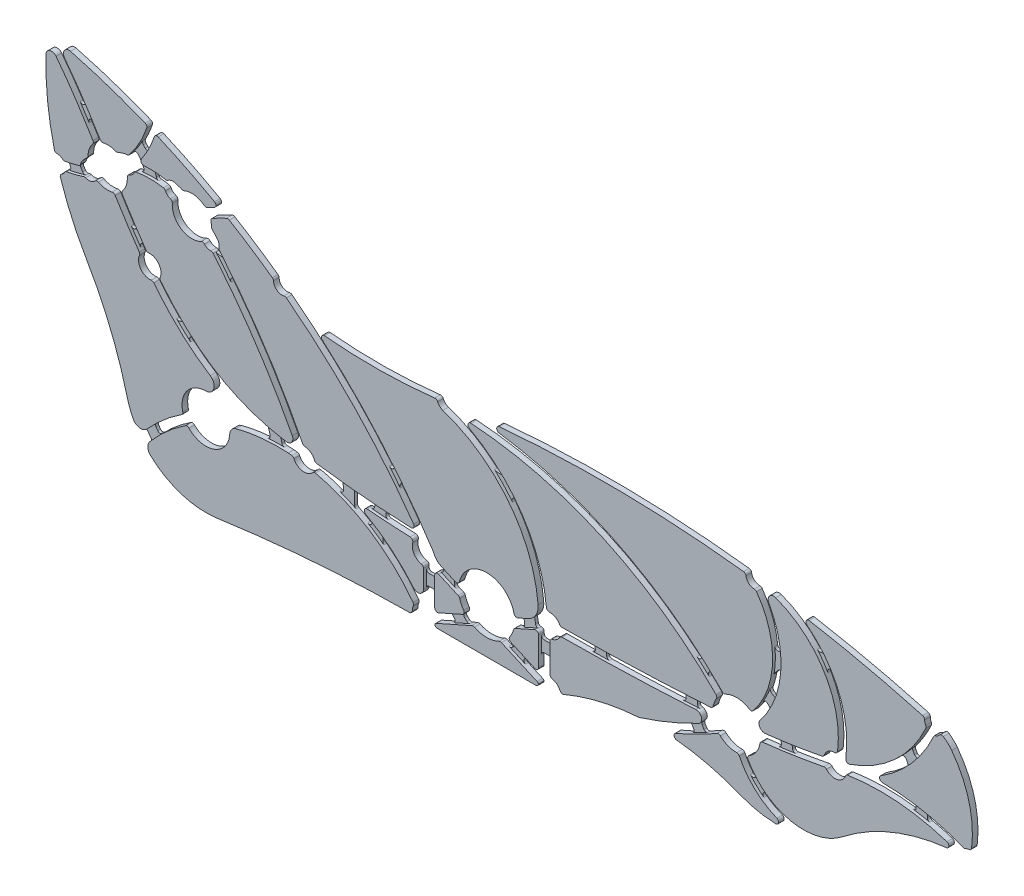
from build123d import *

# Parameters (mm, degrees)
EXTRUDE_1_DEPTH    = 2
EXTRUDE_1_2_DEPTH  = 2
EXTRUDE_1_3_DEPTH  = 2
EXTRUDE_1_4_DEPTH  = 2
EXTRUDE_1_5_DEPTH  = 2
EXTRUDE_1_6_DEPTH  = 2
EXTRUDE_1_7_DEPTH  = 2
EXTRUDE_1_8_DEPTH  = 2
EXTRUDE_1_9_DEPTH  = 2
EXTRUDE_1_10_DEPTH = 2
EXTRUDE_1_11_DEPTH = 2
EXTRUDE_1_12_DEPTH = 2
EXTRUDE_1_13_DEPTH = 2
EXTRUDE_1_14_DEPTH = 2
EXTRUDE_1_15_DEPTH = 2
EXTRUDE_1_16_DEPTH = 2
EXTRUDE_1_17_DEPTH = 2
EXTRUDE_1_18_DEPTH = 2
EXTRUDE_1_19_DEPTH = 2
EXTRUDE_1_20_DEPTH = 2
EXTRUDE_2_DEPTH    = 1


with BuildPart() as part:
    # ｽｹｯﾁ1 → ﾎﾞｽ - 押し出し1 (new body)
    with BuildSketch(Plane.XY):
        with BuildLine():
            Line((22.5, 0.101020514), (22.5, -10.101020514))
            ThreePointArc((22.5, -10.101020514), (22.725403331, -10.733476046), (23.3, -11.080816412))
            ThreePointArc((23.3, -11.080816412), (24.990478153, -11.869901188), (26.139219533, -13.339855069))
            ThreePointArc((26.139219533, -13.339855069), (26.685177052, -13.856277421), (27.436621612, -13.846647678))
            ThreePointArc((27.436621612, -13.846647678), (40.48832194, -9.598088167), (54.063947757, -7.573360277))
            ThreePointArc((54.063947757, -7.573360277), (54.184018837, -7.558239038), (54.301384043, -7.528724215))
            ThreePointArc((54.301384043, -7.528724215), (65.082931287, -3.594550625), (75.487010068, 1.250511558))
            ThreePointArc((75.487010068, 1.250511558), (76.493832753, 3.556551996), (74.448487112, 5.022183474))
            ThreePointArc((74.448487112, 5.022183474), (50.650061214, 3.946700568), (26.831338926, 3.510572931))
            ThreePointArc((26.831338926, 3.510572931), (26.333052589, 3.374773249), (25.968976767, 3.008467879))
            ThreePointArc((25.968976767, 3.008467879), (24.842007836, 1.757316035), (23.3, 1.080816412))
            ThreePointArc((23.3, 1.080816412), (22.725403331, 0.733476046), (22.5, 0.101020514))
        make_face()
    extrude(amount=-EXTRUDE_1_DEPTH)



with BuildPart() as body_2:
    # ｽｹｯﾁ1 → Extrude 1 2 (new body)
    with BuildSketch(Plane.XY):
        with BuildLine():
            Line((-22.5, -6.412581397), (-22.5, 0.101020514))
            ThreePointArc((-22.5, 0.101020514), (-22.725403331, 0.733476046), (-23.3, 1.080816412))
            ThreePointArc((-23.3, 1.080816412), (-25.924769368, 2.933371156), (-26.340268538, 6.119078888))
            ThreePointArc((-26.340268538, 6.119078888), (-26.488503415, 6.982739341), (-27.260130447, 7.398040053))
            ThreePointArc((-27.260130447, 7.398040053), (-34.893320679, 7.7891821), (-42.516080074, 8.347863062))
            ThreePointArc((-42.516080074, 8.347863062), (-43.555392432, 7.64713656), (-43.093796505, 6.481753786))
            ThreePointArc((-43.093796505, 6.481753786), (-33.93186129, 0.147888894), (-26.029417775, -7.701333223))
            ThreePointArc((-26.029417775, -7.701333223), (-23.81401004, -8.291255869), (-22.5, -6.412581397))
        make_face()
    extrude(amount=-EXTRUDE_1_2_DEPTH)


with BuildPart() as body_3:
    # ｽｹｯﾁ1 → Extrude 1 3 (new body)
    with BuildSketch(Plane.XY):
        with BuildLine():
            Line((-17.093861534, -10.955795493), (-8.626043939, -7.192321006))
            ThreePointArc((-8.626043939, -7.192321006), (-8.06909808, -6.547709353), (-8.211074914, -5.70773587))
            ThreePointArc((-8.211074914, -5.70773587), (-9.032200451, -4.291777604), (-9.611336633, -2.760834679))
            ThreePointArc((-9.611336633, -2.760834679), (-9.818127838, -2.380437031), (-10.166331831, -2.123106598))
            Line((-10.166331831, -2.123106598), (-17.093861534, 0.955795493))
            ThreePointArc((-17.093861534, 0.955795493), (-18.044913541, 0.880476182), (-18.5, 0.041983944))
            Line((-18.5, 0.041983944), (-18.5, -10.041983944))
            ThreePointArc((-18.5, -10.041983944), (-18.044913541, -10.880476182), (-17.093861534, -10.955795493))
        make_face()
    extrude(amount=-EXTRUDE_1_3_DEPTH)


with BuildPart() as body_4:
    # ｽｹｯﾁ1 → Extrude 1 4 (new body)
    with BuildSketch(Plane.XY):
        with BuildLine():
            Line((8.626043939, -7.192321006), (17.093861534, -10.955795493))
            ThreePointArc((17.093861534, -10.955795493), (18.044913541, -10.880476182), (18.5, -10.041983944))
            Line((18.5, -10.041983944), (18.5, 0.041983944))
            ThreePointArc((18.5, 0.041983944), (18.044913541, 0.880476182), (17.093861534, 0.955795493))
            Line((17.093861534, 0.955795493), (10.166331831, -2.123106598))
            ThreePointArc((10.166331831, -2.123106598), (9.818127838, -2.380437031), (9.611336633, -2.760834679))
            ThreePointArc((9.611336633, -2.760834679), (9.032200451, -4.291777604), (8.211074914, -5.70773587))
            ThreePointArc((8.211074914, -5.70773587), (8.06909808, -6.547709353), (8.626043939, -7.192321006))
        make_face()
    extrude(amount=-EXTRUDE_1_4_DEPTH)


with BuildPart() as body_5:
    # ｽｹｯﾁ1 → Extrude 1 5 (new body)
    with BuildSketch(Plane.XY):
        with BuildLine():
            Line((11.118968747, 1.583240188), (14.780704116, 3.210678129))
            ThreePointArc((14.780704116, 3.210678129), (17.508416253, 5.639452419), (18.322470408, 9.199884119))
            ThreePointArc((18.322470408, 9.199884119), (7.814521193, 35.812462193), (-15.610951372, 52.240899233))
            ThreePointArc((-15.610951372, 52.240899233), (-16.726416816, 52.906959729), (-17.45567904, 53.982169639))
            ThreePointArc((-17.45567904, 53.982169639), (-17.871800431, 54.471525722), (-18.499758812, 54.606783477))
            ThreePointArc((-18.499758812, 54.606783477), (-38.112812762, 53.374184357), (-57.747756386, 54.186695724))
            ThreePointArc((-57.747756386, 54.186695724), (-58.759792741, 53.585885084), (-58.499178516, 52.438160712))
            ThreePointArc((-58.499178516, 52.438160712), (-37.276714505, 31.160374537), (-19.152035998, 7.188866612))
            ThreePointArc((-19.152035998, 7.188866612), (-18.959270279, 6.860976368), (-18.798519535, 6.516259335))
            ThreePointArc((-18.798519535, 6.516259335), (-17.758858971, 4.928471706), (-16.202361285, 3.84252576))
            Line((-16.202361285, 3.84252576), (-11.118968747, 1.583240188))
            ThreePointArc((-11.118968747, 1.583240188), (-10.267282975, 1.601793339), (-9.738936619, 2.270047033))
            ThreePointArc((-9.738936619, 2.270047033), (0, 10), (9.738936619, 2.270047033))
            ThreePointArc((9.738936619, 2.270047033), (10.267282975, 1.601793339), (11.118968747, 1.583240188))
        make_face()
    extrude(amount=-EXTRUDE_1_5_DEPTH)


with BuildPart() as body_6:
    # ｽｹｯﾁ1 → Extrude 1 6 (new body)
    with BuildSketch(Plane.XY):
        with BuildLine():
            Line((-17.5, -16), (17.5, -16))
            ThreePointArc((17.5, -16), (18.127636647, -15.778506416), (18.477238313, -15.212144479))
            ThreePointArc((18.477238313, -15.212144479), (18.268989106, -14.854674582), (17.933872224, -14.612086178))
            Line((17.933872224, -14.612086178), (5.236576226, -8.968843512))
            ThreePointArc((5.236576226, -8.968843512), (4.812235497, -8.882820735), (4.391307055, -8.984231873))
            ThreePointArc((4.391307055, -8.984231873), (0, -10), (-4.391307055, -8.984231873))
            ThreePointArc((-4.391307055, -8.984231873), (-4.812235497, -8.882820735), (-5.236576226, -8.968843512))
            Line((-5.236576226, -8.968843512), (-17.933872224, -14.612086178))
            ThreePointArc((-17.933872224, -14.612086178), (-18.268989106, -14.854674582), (-18.477238313, -15.212144479))
            ThreePointArc((-18.477238313, -15.212144479), (-18.127636647, -15.778506416), (-17.5, -16))
        make_face()
    extrude(amount=-EXTRUDE_1_6_DEPTH)


with BuildPart() as body_7:
    # ｽｹｯﾁ1 → Extrude 1 7 (new body)
    with BuildSketch(Plane.XY):
        with BuildLine():
            ThreePointArc((83.211270872, 1.275804061), (85.918070339, -0.421597665), (89.060304278, -0.999786079))
            ThreePointArc((89.060304278, -0.999786079), (89.595121172, -1.150343934), (89.967031901, -1.563114074))
            ThreePointArc((89.967031901, -1.563114074), (95.498956322, -9.057744291), (103.356558634, -14.060718986))
            ThreePointArc((103.356558634, -14.060718986), (103.962078134, -15.191111022), (102.957342201, -15.987945839))
            ThreePointArc((102.957342201, -15.987945839), (96.419112305, -15.235486438), (90.117629525, -13.336549869))
            ThreePointArc((90.117629525, -13.336549869), (79.072499433, -9.782229594), (67.637822736, -7.813407558))
            ThreePointArc((67.637822736, -7.813407558), (66.749100435, -6.968649503), (67.34675765, -5.898019149))
            ThreePointArc((67.34675765, -5.898019149), (74.799057097, -2.464433401), (82.031739222, 1.410432715))
            ThreePointArc((82.031739222, 1.410432715), (82.64364503, 1.537095003), (83.211270872, 1.275804061))
        make_face()
    extrude(amount=-EXTRUDE_1_7_DEPTH)


with BuildPart() as body_8:
    # ｽｹｯﾁ1 → Extrude 1 8 (new body)
    with BuildSketch(Plane.XY):
        with BuildLine():
            ThreePointArc((163.920291551, 8.977503239), (146.403950854, 12.457005785), (128.557163274, 11.807927609))
            ThreePointArc((128.557163274, 11.807927609), (128.07237572, 11.59059704), (127.76731798, 11.155635749))
            ThreePointArc((127.76731798, 11.155635749), (124.75804267, 8.572485352), (121.003592282, 9.850180989))
            ThreePointArc((121.003592282, 9.850180989), (120.575847385, 10.134684344), (120.063293842, 10.169278015))
            ThreePointArc((120.063293842, 10.169278015), (109.189695688, 8.283956274), (98.247377431, 6.850343342))
            ThreePointArc((98.247377431, 6.850343342), (97.672725088, 6.585818326), (97.371810397, 6.029357053))
            ThreePointArc((97.371810397, 6.029357053), (96.028031748, 2.719124583), (93.442710672, 0.253461386))
            ThreePointArc((93.442710672, 0.253461386), (93.00002742, -0.338132848), (93.084381906, -1.072187697))
            ThreePointArc((93.084381906, -1.072187697), (108.261136719, -12.427077278), (126.720890547, -8.125345919))
            ThreePointArc((126.720890547, -8.125345919), (144.171431804, 2.021447824), (163.725732783, 7.032248826))
            ThreePointArc((163.725732783, 7.032248826), (164.608066794, 7.92635712), (163.920291551, 8.977503239))
        make_face()
    extrude(amount=-EXTRUDE_1_8_DEPTH)


with BuildPart() as body_9:
    # ｽｹｯﾁ1 → Extrude 1 9 (new body)
    with BuildSketch(Plane.XY):
        with BuildLine():
            ThreePointArc((129.217245632, 15.498903244), (145.340870587, 25.04107642), (156.400178828, 40.164437549))
            ThreePointArc((156.400178828, 40.164437549), (156.490114246, 40.616134725), (156.368067103, 41.060232927))
            ThreePointArc((156.368067103, 41.060232927), (156.085215089, 41.790050054), (156.000775173, 42.568194129))
            ThreePointArc((156.000775173, 42.568194129), (155.803951642, 43.187014896), (155.268554706, 43.554477497))
            ThreePointArc((155.268554706, 43.554477497), (135.171119836, 48.606684839), (114.850046871, 52.666941105))
            ThreePointArc((114.850046871, 52.666941105), (113.765093768, 52.089460809), (114.059534107, 50.896183133))
            ThreePointArc((114.059534107, 50.896183133), (125.547381919, 35.580716416), (127.900790598, 16.580831267))
            ThreePointArc((127.900790598, 16.580831267), (128.25649785, 15.67177038), (129.217245632, 15.498903244))
        make_face()
    extrude(amount=-EXTRUDE_1_9_DEPTH)


with BuildPart() as body_10:
    # ｽｹｯﾁ1 → Extrude 1 10 (new body)
    with BuildSketch(Plane.XY):
        with BuildLine():
            ThreePointArc((171.785964151, 10.492355035), (171.155696028, 10.378741184), (170.563904339, 10.133937974))
            ThreePointArc((170.563904339, 10.133937974), (170.14622041, 10.013780427), (169.717010958, 10.08216864))
            ThreePointArc((169.717010958, 10.08216864), (155.581300438, 14.221758305), (140.92626069, 15.699704338))
            ThreePointArc((140.92626069, 15.699704338), (139.972472291, 16.427013854), (140.402865662, 17.546591002))
            ThreePointArc((140.402865662, 17.546591002), (151.384643178, 26.924630489), (159.197974761, 39.069543482))
            ThreePointArc((159.197974761, 39.069543482), (159.454634512, 39.413102568), (159.831599898, 39.617563251))
            ThreePointArc((159.831599898, 39.617563251), (160.648344956, 39.993416886), (161.317043281, 40.594400243))
            ThreePointArc((161.317043281, 40.594400243), (161.947741849, 40.949117243), (162.652608619, 40.785508959))
            ThreePointArc((162.652608619, 40.785508959), (164.259804057, 39.486741818), (165.635293674, 37.944697209))
            ThreePointArc((165.635293674, 37.944697209), (171.77520359, 25.346722117), (172.706566648, 11.363159157))
            ThreePointArc((172.706566648, 11.363159157), (172.401803697, 10.763324084), (171.785964151, 10.492355035))
        make_face()
    extrude(amount=-EXTRUDE_1_10_DEPTH)


with BuildPart() as body_11:
    # ｽｹｯﾁ1 → Extrude 1 11 (new body)
    with BuildSketch(Plane.XY):
        with BuildLine():
            ThreePointArc((93.586754605, 14.6562338), (89.394333262, 15.990848089), (85.096260122, 15.05055064))
            ThreePointArc((85.096260122, 15.05055064), (84.479111763, 14.951393184), (83.923649691, 15.238039629))
            ThreePointArc((83.923649691, 15.238039629), (47.483352354, 41.826061968), (4.422429146, 55.263885244))
            ThreePointArc((4.422429146, 55.263885244), (3.560849299, 56.278744516), (4.470999079, 57.250282757))
            ThreePointArc((4.470999079, 57.250282757), (48.007817114, 58.908356302), (91.48378022, 56.07209741))
            ThreePointArc((91.48378022, 56.07209741), (92.069225942, 55.791149679), (92.358682449, 55.209863819))
            ThreePointArc((92.358682449, 55.209863819), (93.350087626, 53.351369569), (95.318967313, 52.602772294))
            ThreePointArc((95.318967313, 52.602772294), (95.774491653, 52.49062391), (96.128746209, 52.183079777))
            ThreePointArc((96.128746209, 52.183079777), (101.822459182, 33.316779439), (94.900870104, 14.865566457))
            ThreePointArc((94.900870104, 14.865566457), (94.283684874, 14.510594718), (93.586754605, 14.6562338))
        make_face()
    extrude(amount=-EXTRUDE_1_11_DEPTH)


with BuildPart() as body_12:
    # ｽｹｯﾁ1 → Extrude 1 12 (new body)
    with BuildSketch(Plane.XY):
        with BuildLine():
            ThreePointArc((81.667277078, 13.253873919), (41.702064453, 41.277821121), (-5.609573539, 53.284850211))
            ThreePointArc((-5.609573539, 53.284850211), (-6.637189872, 52.564938691), (-6.152522338, 51.407629179))
            ThreePointArc((-6.152522338, 51.407629179), (12.757832942, 34.089272661), (21.271842987, 9.901700598))
            ThreePointArc((21.271842987, 9.901700598), (21.611427135, 9.239911484), (22.314015361, 8.995673875))
            ThreePointArc((22.314015361, 8.995673875), (24.414609558, 8.512017973), (25.959198864, 7.008467879))
            ThreePointArc((25.959198864, 7.008467879), (26.327181142, 6.642729772), (26.828894412, 6.510596833))
            ThreePointArc((26.828894412, 6.510596833), (53.301872163, 7.036667802), (79.74722804, 8.355172349))
            ThreePointArc((79.74722804, 8.355172349), (80.341592557, 8.601026945), (80.663274603, 9.158013769))
            ThreePointArc((80.663274603, 9.158013769), (81.101716083, 10.641195817), (81.801654702, 12.020378853))
            ThreePointArc((81.801654702, 12.020378853), (81.94890883, 12.660487916), (81.667277078, 13.253873919))
        make_face()
    extrude(amount=-EXTRUDE_1_12_DEPTH)


with BuildPart() as body_13:
    # ｽｹｯﾁ1 → Extrude 1 13 (new body)
    with BuildSketch(Plane.XY):
        with BuildLine():
            ThreePointArc((97.424637255, 13.215415929), (97.235079465, 10.997428592), (99.214022424, 9.978024479))
            ThreePointArc((99.214022424, 9.978024479), (109.36232121, 11.345501175), (119.449838366, 13.106171051))
            ThreePointArc((119.449838366, 13.106171051), (119.918131969, 13.335906367), (120.207034495, 13.770201826))
            ThreePointArc((120.207034495, 13.770201826), (121.659362935, 15.743673555), (123.98999328, 16.499987483))
            ThreePointArc((123.98999328, 16.499987483), (124.649769443, 16.750726015), (124.979615741, 17.374725869))
            ThreePointArc((124.979615741, 17.374725869), (120.295248245, 39.392547584), (102.944576602, 53.73416414))
            ThreePointArc((102.944576602, 53.73416414), (100.727848949, 53.158409228), (100.505114473, 50.878987248))
            ThreePointArc((100.505114473, 50.878987248), (104.726719606, 31.575944409), (97.424637255, 13.215415929))
        make_face()
    extrude(amount=-EXTRUDE_1_13_DEPTH)


with BuildPart() as body_14:
    # ｽｹｯﾁ1 → Extrude 1 14 (new body)
    with BuildSketch(Plane.XY):
        with BuildLine():
            ThreePointArc((-92.646482628, 72.972153264), (-95.226633677, 71.724656509), (-97.750631704, 70.36713614))
            ThreePointArc((-97.750631704, 70.36713614), (-98.178932991, 69.886768371), (-98.225822663, 69.244898802))
            ThreePointArc((-98.225822663, 69.244898802), (-98.063053837, 68.418663332), (-98.000680849, 67.578860765))
            ThreePointArc((-98.000680849, 67.578860765), (-97.921285564, 67.202082756), (-97.705410986, 66.8832357))
            ThreePointArc((-97.705410986, 66.8832357), (-96.845691965, 65.995488705), (-96.021295968, 65.074846127))
            ThreePointArc((-96.021295968, 65.074846127), (-95.395423067, 63.8877696), (-95.349720401, 62.546583993))
            ThreePointArc((-95.349720401, 62.546583993), (-95.336157636, 62.105899259), (-95.134397943, 61.713878839))
            ThreePointArc((-95.134397943, 61.713878839), (-79.093035157, 40.212538503), (-65.583431059, 17.036612343))
            ThreePointArc((-65.583431059, 17.036612343), (-65.240913382, 16.654395429), (-64.753909299, 16.492422744))
            ThreePointArc((-64.753909299, 16.492422744), (-62.655797065, 15.741097437), (-61.285349547, 13.983702131))
            ThreePointArc((-61.285349547, 13.983702131), (-60.972999003, 13.567125642), (-60.493566976, 13.364040033))
            ThreePointArc((-60.493566976, 13.364040033), (-43.722386211, 11.463371837), (-26.878319095, 10.385203561))
            ThreePointArc((-26.878319095, 10.385203561), (-25.960207207, 10.906984019), (-26.021967296, 11.961199356))
            ThreePointArc((-26.021967296, 11.961199356), (-46.898048291, 37.235706645), (-71.343129401, 59.077169187))
            ThreePointArc((-71.343129401, 59.077169187), (-71.750387624, 59.262904595), (-72.197875937, 59.252363596))
            ThreePointArc((-72.197875937, 59.252363596), (-74.72769572, 59.751974852), (-75.935182614, 62.030477638))
            ThreePointArc((-75.935182614, 62.030477638), (-76.054051204, 62.462018089), (-76.349274765, 62.798470094))
            ThreePointArc((-76.349274765, 62.798470094), (-83.925565639, 68.022389418), (-91.716533423, 72.920382631))
            ThreePointArc((-91.716533423, 72.920382631), (-92.1751128, 73.061144555), (-92.646482628, 72.972153264))
        make_face()
    extrude(amount=-EXTRUDE_1_14_DEPTH)


with BuildPart() as body_15:
    # ｽｹｯﾁ1 → Extrude 1 15 (new body)
    with BuildSketch(Plane.XY):
        with BuildLine():
            ThreePointArc((-150.204030248, 61.786911622), (-147.74564025, 62.291578487), (-145.326579343, 62.959795782))
            ThreePointArc((-145.326579343, 62.959795782), (-144.882580356, 63.24428851), (-144.645024595, 63.715073466))
            ThreePointArc((-144.645024595, 63.715073466), (-144.399069128, 64.437692205), (-143.978704032, 65.074846127))
            ThreePointArc((-143.978704032, 65.074846127), (-143.154308035, 65.995488705), (-142.294589014, 66.8832357))
            ThreePointArc((-142.294589014, 66.8832357), (-142.078714436, 67.202082756), (-141.999319151, 67.578860765))
            ThreePointArc((-141.999319151, 67.578860765), (-141.551530732, 69.946479233), (-140.327435168, 72.021984408))
            ThreePointArc((-140.327435168, 72.021984408), (-140.091472024, 72.593588521), (-140.236781197, 73.194666812))
            add(Edge.make_bspline(
                [(-140.236781197, 73.194666812), (-142.696287318, 77.192352385), (-146.657650725, 83.453304938), (-151.189593008, 89.761627373), (-153.104495244, 92.236934413), (-153.38430558, 92.594581239)],
                knots=[0.052703532, 0.052703532, 0.052703532, 0.052703532, 0.161129074, 0.224621322, 0.235410038, 0.235410038, 0.235410038, 0.235410038], degree=3))
            ThreePointArc((-153.38430558, 92.594581239), (-155.584650657, 93.261989436), (-156.95871287, 91.41837744))
            ThreePointArc((-156.95871287, 91.41837744), (-156.407303766, 77.356990536), (-153.974336047, 63.496711978))
            ThreePointArc((-153.974336047, 63.496711978), (-153.617445554, 62.946282157), (-152.996239059, 62.735459239))
            ThreePointArc((-152.996239059, 62.735459239), (-151.944301544, 62.552841011), (-151.022937008, 62.013388192))
            ThreePointArc((-151.022937008, 62.013388192), (-150.638732608, 61.80885322), (-150.204030248, 61.786911622))
        make_face()
    extrude(amount=-EXTRUDE_1_15_DEPTH)


with BuildPart() as body_16:
    # ｽｹｯﾁ1 → Extrude 1 16 (new body)
    with BuildSketch(Plane.XY):
        with BuildLine():
            ThreePointArc((-122.987570022, 76.057235981), (-120.363163566, 80.53748433), (-118.334402634, 85.317051632))
            ThreePointArc((-118.334402634, 85.317051632), (-117.791441284, 85.902420306), (-116.993029265, 85.9037473))
            ThreePointArc((-116.993029265, 85.9037473), (-106.841656639, 81.189233057), (-96.946878275, 75.957562975))
            ThreePointArc((-96.946878275, 75.957562975), (-96.437083464, 75.068877577), (-96.976789503, 74.198033231))
            ThreePointArc((-96.976789503, 74.198033231), (-98.233931235, 73.530059693), (-99.477126101, 72.836474436))
            ThreePointArc((-99.477126101, 72.836474436), (-100.053312977, 72.707932638), (-100.601598753, 72.926786512))
            ThreePointArc((-100.601598753, 72.926786512), (-104.035554327, 74.414473762), (-107.745169421, 73.920489866))
            ThreePointArc((-107.745169421, 73.920489866), (-108.121822546, 73.840504228), (-108.50077585, 73.908766026))
            ThreePointArc((-108.50077585, 73.908766026), (-109.660624664, 74.335336357), (-110.836246698, 74.71628826))
            ThreePointArc((-110.836246698, 74.71628826), (-112.244264312, 74.796025008), (-113.533139444, 74.223598206))
            ThreePointArc((-113.533139444, 74.223598206), (-113.911582503, 74.043529717), (-114.330580957, 74.03435888))
            ThreePointArc((-114.330580957, 74.03435888), (-118.195023505, 74.518282292), (-122.089604161, 74.499854314))
            ThreePointArc((-122.089604161, 74.499854314), (-123.025245698, 74.997944172), (-122.987570022, 76.057235981))
        make_face()
    extrude(amount=-EXTRUDE_1_16_DEPTH)


with BuildPart() as body_17:
    # ｽｹｯﾁ1 → Extrude 1 17 (new body)
    with BuildSketch(Plane.XY):
        with BuildLine():
            ThreePointArc((-106.070500124, 1.550291751), (-97.009254914, -0.45647182), (-91.513444146, 7.022119544))
            ThreePointArc((-91.513444146, 7.022119544), (-90.839066816, 8.754383733), (-89.273595206, 9.756792154))
            ThreePointArc((-89.273595206, 9.756792154), (-80.049706865, 11.400344352), (-70.682393404, 11.586941397))
            ThreePointArc((-70.682393404, 11.586941397), (-70.643120282, 11.583872322), (-70.603998507, 11.579258847))
            ThreePointArc((-70.603998507, 11.579258847), (-70.017526668, 11.500504899), (-69.430506154, 11.425950762))
            ThreePointArc((-69.430506154, 11.425950762), (-68.960800584, 11.239294826), (-68.642371358, 10.846781657))
            ThreePointArc((-68.642371358, 10.846781657), (-65.564057635, 8.539969825), (-61.964082393, 9.895541461))
            ThreePointArc((-61.964082393, 9.895541461), (-61.519642672, 10.193671151), (-60.985116277, 10.219929694))
            ThreePointArc((-60.985116277, 10.219929694), (-41.602155025, 2.06939678), (-26.224992097, -12.271915363))
            ThreePointArc((-26.224992097, -12.271915363), (-26.029919562, -12.770267331), (-26.119760126, -13.297843535))
            ThreePointArc((-26.119760126, -13.297843535), (-26.405864749, -14.137317809), (-26.499953909, -15.019202234))
            ThreePointArc((-26.499953909, -15.019202234), (-26.787762201, -15.725999505), (-27.49034138, -16.023956702))
            ThreePointArc((-27.49034138, -16.023956702), (-61.783072383, -17.486582136), (-95.904497639, -21.209351445))
            ThreePointArc((-95.904497639, -21.209351445), (-108.674407076, -20.172272438), (-119.751248422, -13.734127855))
            ThreePointArc((-119.751248422, -13.734127855), (-120.70255746, -11.718381768), (-120.000805926, -9.602781154))
            ThreePointArc((-120.000805926, -9.602781154), (-114.070402793, -3.50960152), (-107.337748418, 1.683459661))
            ThreePointArc((-107.337748418, 1.683459661), (-106.680167747, 1.84485003), (-106.070500124, 1.550291751))
        make_face()
    extrude(amount=-EXTRUDE_1_17_DEPTH)


with BuildPart() as body_18:
    # ｽｹｯﾁ1 → Extrude 1 18 (new body)
    with BuildSketch(Plane.XY):
        with BuildLine():
            ThreePointArc((-100.50788434, 61.092108441), (-99.463987015, 60.354774164), (-98.207911317, 60.118856168))
            ThreePointArc((-98.207911317, 60.118856168), (-97.769172649, 60.031474199), (-97.41243615, 59.761536619))
            ThreePointArc((-97.41243615, 59.761536619), (-82.191064591, 39.453879405), (-69.257723432, 17.617675978))
            ThreePointArc((-69.257723432, 17.617675978), (-69.404595356, 15.529642509), (-71.333254774, 14.716175865))
            add(Edge.make_bspline(
                [(-116.153912199, 41.910100809), (-114.252250774, 39.538319712), (-110.605870721, 35.341540936), (-104.787291443, 29.804254012), (-98.790819511, 25.172870999), (-92.181209568, 21.200378892), (-86.082324681, 18.506149632), (-80.797913885, 16.762501548), (-76.620780353, 15.671863381), (-73.409438449, 15.043486715), (-71.614504166, 14.759136638), (-71.333254774, 14.716175865)],
                knots=[0.541498181, 0.541498181, 0.541498181, 0.541498181, 0.614546681, 0.676001349, 0.737456018, 0.798910686, 0.860365354, 0.891092688, 0.921820022, 0.952547356, 0.958224109, 0.958224109, 0.958224109, 0.958224109], degree=3))
            ThreePointArc((-116.153912199, 41.910100809), (-116.363463713, 42.392765504), (-116.298978924, 42.914990318))
            ThreePointArc((-116.298978924, 42.914990318), (-116.797403013, 46.828904068), (-120.411783315, 48.411118481))
            ThreePointArc((-120.411783315, 48.411118481), (-120.929284322, 48.495781267), (-121.332792985, 48.830678024))
            add(Edge.make_bspline(
                [(-129.760514936, 61.769694758), (-129.38878449, 61.166659042), (-126.654423832, 56.750949776), (-123.860286294, 52.425795928), (-121.332792985, 48.830678024)],
                knots=[0.352317169, 0.352317169, 0.352317169, 0.352317169, 0.368728009, 0.472763953, 0.472763953, 0.472763953, 0.472763953], degree=3))
            ThreePointArc((-129.760514936, 61.769694758), (-129.906330096, 62.370863984), (-129.67059794, 62.942787797))
            ThreePointArc((-129.67059794, 62.942787797), (-128.348605081, 65.299730994), (-128.017920694, 67.981800007))
            ThreePointArc((-128.017920694, 67.981800007), (-127.852816871, 68.607581037), (-127.339079784, 69.00119935))
            ThreePointArc((-127.339079784, 69.00119935), (-126.29654459, 69.60730952), (-125.576906384, 70.574971663))
            ThreePointArc((-125.576906384, 70.574971663), (-125.281409422, 70.943694366), (-124.849604668, 71.135578553))
            ThreePointArc((-124.849604668, 71.135578553), (-120, 71.572377608), (-115.150395332, 71.135578553))
            ThreePointArc((-115.150395332, 71.135578553), (-114.718590578, 70.943694366), (-114.423093616, 70.574971663))
            ThreePointArc((-114.423093616, 70.574971663), (-113.70345541, 69.60730952), (-112.660920216, 69.00119935))
            ThreePointArc((-112.660920216, 69.00119935), (-112.147183129, 68.607581037), (-111.982079306, 67.981800007))
            ThreePointArc((-111.982079306, 67.981800007), (-108.818181818, 61.614248932), (-101.714859342, 61.299981825))
            ThreePointArc((-101.714859342, 61.299981825), (-101.075825626, 61.402437082), (-100.50788434, 61.092108441))
        make_face()
    extrude(amount=-EXTRUDE_1_18_DEPTH)


with BuildPart() as body_19:
    # ｽｹｯﾁ1 → Extrude 1 19 (new body)
    with BuildSketch(Plane.XY):
        with BuildLine():
            ThreePointArc((-148.233146487, 96.700551949), (-150.406889536, 95.872080726), (-150.326318977, 93.547208301))
            add(Edge.make_bspline(
                [(-150.326318977, 93.547208301), (-148.708850772, 91.442758638), (-144.300186764, 85.33672362), (-140.240473974, 78.92571989), (-137.670112992, 74.747829517)],
                knots=[0.06143114, 0.06143114, 0.06143114, 0.06143114, 0.122909336, 0.235583634, 0.235583634, 0.235583634, 0.235583634], degree=3))
            ThreePointArc((-137.670112992, 74.747829517), (-137.203180916, 74.348824921), (-136.591096214, 74.298006141))
            ThreePointArc((-136.591096214, 74.298006141), (-134.392874909, 74.454853433), (-132.254830579, 73.920489866))
            ThreePointArc((-132.254830579, 73.920489866), (-131.878177454, 73.840504228), (-131.49922415, 73.908766026))
            ThreePointArc((-131.49922415, 73.908766026), (-130.339375336, 74.335336357), (-129.163753302, 74.71628826))
            ThreePointArc((-129.163753302, 74.71628826), (-128.667281007, 74.821664241), (-128.160150137, 74.841841395))
            ThreePointArc((-128.160150137, 74.841841395), (-127.703850215, 74.929373539), (-127.336357893, 75.213663689))
            ThreePointArc((-127.336357893, 75.213663689), (-123.702181112, 80.633649045), (-121.064206489, 86.602281387))
            ThreePointArc((-121.064206489, 86.602281387), (-121.100824658, 87.340386295), (-121.634308586, 87.851790875))
            ThreePointArc((-121.634308586, 87.851790875), (-134.790692615, 92.706125691), (-148.233146487, 96.700551949))
        make_face()
    extrude(amount=-EXTRUDE_1_19_DEPTH)


with BuildPart() as body_20:
    # ｽｹｯﾁ1 → Extrude 1 20 (new body)
    with BuildSketch(Plane.XY):
        with BuildLine():
            ThreePointArc((-151.836934791, 56.014102551), (-147.745407286, 45.4518558), (-142.536293001, 35.39368588))
            ThreePointArc((-142.536293001, 35.39368588), (-134.07925039, 18.380808166), (-128.103750797, 0.346036683))
            ThreePointArc((-128.103750797, 0.346036683), (-127.166359581, -2.648345044), (-125.910949972, -5.523926887))
            ThreePointArc((-125.910949972, -5.523926887), (-123.628983467, -7.150042408), (-120.99938497, -6.182140264))
            ThreePointArc((-120.99938497, -6.182140264), (-115.180555638, -0.495167069), (-108.676920035, 4.393919026))
            ThreePointArc((-108.676920035, 4.393919026), (-108.294327864, 4.864318046), (-108.253865555, 5.469309624))
            ThreePointArc((-108.253865555, 5.469309624), (-106.702187254, 12.72787586), (-100.0397327, 15.999907136))
            ThreePointArc((-100.0397327, 15.999907136), (-97.170625427, 18.170683147), (-98.448115048, 21.534024536))
            add(Edge.make_bspline(
                [(-98.448115048, 21.534024536), (-100.538792211, 22.858680396), (-104.759265589, 25.876093342), (-111.587113707, 31.947718613), (-116.038558432, 36.965392293), (-118.549804324, 40.102350396)],
                knots=[0.54080668, 0.54080668, 0.54080668, 0.54080668, 0.597594707, 0.661086955, 0.755202759, 0.755202759, 0.755202759, 0.755202759], degree=3))
            ThreePointArc((-118.549804324, 40.102350396), (-118.958889754, 40.405801694), (-119.464375375, 40.468394558))
            ThreePointArc((-119.464375375, 40.468394558), (-123.202688843, 42.03595994), (-123.651791065, 46.064676361))
            ThreePointArc((-123.651791065, 46.064676361), (-123.569384023, 46.569027429), (-123.746924759, 47.048235325))
            add(Edge.make_bspline(
                [(-123.746924759, 47.048235325), (-126.032249103, 50.295893269), (-128.895331228, 54.684284987), (-131.67046671, 59.15087034), (-132.32709633, 60.216119374)],
                knots=[0.352132248, 0.352132248, 0.352132248, 0.352132248, 0.444483029, 0.473304271, 0.473304271, 0.473304271, 0.473304271], degree=3))
            ThreePointArc((-132.32709633, 60.216119374), (-132.7941666, 60.614639845), (-133.406069368, 60.665119596))
            ThreePointArc((-133.406069368, 60.665119596), (-135.903222204, 60.539748523), (-138.285140658, 61.299981825))
            ThreePointArc((-138.285140658, 61.299981825), (-138.924174374, 61.402437082), (-139.49211566, 61.092108441))
            ThreePointArc((-139.49211566, 61.092108441), (-141.061105651, 60.187537156), (-142.864802758, 60.35080242))
            ThreePointArc((-142.864802758, 60.35080242), (-143.215619048, 60.427899087), (-143.571046826, 60.376062231))
            ThreePointArc((-143.571046826, 60.376062231), (-146.562441547, 59.49371431), (-149.612934356, 58.844504131))
            ThreePointArc((-149.612934356, 58.844504131), (-150.029216938, 58.669006172), (-150.325785264, 58.328215988))
            ThreePointArc((-150.325785264, 58.328215988), (-150.789990268, 57.680099045), (-151.40850633, 57.177128133))
            ThreePointArc((-151.40850633, 57.177128133), (-151.824628715, 56.66999307), (-151.836934791, 56.014102551))
        make_face()
    extrude(amount=-EXTRUDE_1_20_DEPTH)


with BuildPart() as part_1:
    add(part.part)

    add(body_2.part)  # ﾎﾞｽ - 押し出し2 merges body 2

    add(body_3.part)  # ﾎﾞｽ - 押し出し2 merges body 3

    add(body_4.part)  # ﾎﾞｽ - 押し出し2 merges body 4

    add(body_5.part)  # ﾎﾞｽ - 押し出し2 merges body 5

    add(body_6.part)  # ﾎﾞｽ - 押し出し2 merges body 6

    add(body_7.part)  # ﾎﾞｽ - 押し出し2 merges body 7

    add(body_8.part)  # ﾎﾞｽ - 押し出し2 merges body 8

    add(body_9.part)  # ﾎﾞｽ - 押し出し2 merges body 9

    add(body_10.part)  # ﾎﾞｽ - 押し出し2 merges body 10

    add(body_11.part)  # ﾎﾞｽ - 押し出し2 merges body 11

    add(body_12.part)  # ﾎﾞｽ - 押し出し2 merges body 12

    add(body_13.part)  # ﾎﾞｽ - 押し出し2 merges body 13

    add(body_14.part)  # ﾎﾞｽ - 押し出し2 merges body 14

    add(body_15.part)  # ﾎﾞｽ - 押し出し2 merges body 15

    add(body_16.part)  # ﾎﾞｽ - 押し出し2 merges body 16

    add(body_17.part)  # ﾎﾞｽ - 押し出し2 merges body 17

    add(body_18.part)  # ﾎﾞｽ - 押し出し2 merges body 18

    add(body_19.part)  # ﾎﾞｽ - 押し出し2 merges body 19

    add(body_20.part)  # ﾎﾞｽ - 押し出し2 merges body 20
    # ｽｹｯﾁ2 → ﾎﾞｽ - 押し出し2 (add)
    with BuildSketch(Plane(origin=(0, 0, -2), x_dir=(-1, 0, 0), z_dir=(0, 0, -1))):
        with BuildLine():
            ThreePointArc((19.5, -1.5), (18.792893219, -1.207106781), (18.5, -0.5))
            Line((18.5, -0.5), (18.5, -6.5))
            ThreePointArc((18.5, -6.5), (18.792893219, -5.792893219), (19.5, -5.5))
            Line((19.5, -5.5), (21.501273939, -5.5))
            ThreePointArc((21.501273939, -5.5), (22.198002174, -5.782664815), (22.500849293, -6.470860466))
            ThreePointArc((22.500849293, -6.470860466), (22.500212334, -6.441724025), (22.5, -6.412581397))
            Line((22.5, -6.412581397), (22.5, -0.5))
            ThreePointArc((22.5, -0.5), (22.207106781, -1.207106781), (21.5, -1.5))
            Line((21.5, -1.5), (19.5, -1.5))
        make_face()
        with BuildLine():
            ThreePointArc((12.490856196, -0.478028756), (12.319505304, -1.000636204), (11.897726166, -1.353598004))
            Line((11.897726166, -1.353598004), (17.093861534, 0.955795493))
            ThreePointArc((17.093861534, 0.955795493), (17.263355075, 1.013580146), (17.440437139, 1.040208501))
            ThreePointArc((17.440437139, 1.040208501), (16.738781017, 1.271806523), (16.387681462, 1.921951168))
            ThreePointArc((16.387681462, 1.921951168), (16.311675863, 2.485805811), (16.216275463, 3.046704796))
            ThreePointArc((16.216275463, 3.046704796), (16.289323816, 3.646496462), (16.694511523, 4.094725227))
            ThreePointArc((16.694511523, 4.094725227), (16.451925774, 3.961816224), (16.202361285, 3.84252576))
            Line((16.202361285, 3.84252576), (11.118968747, 1.583240188))
            ThreePointArc((11.118968747, 1.583240188), (11.108113766, 1.578492557), (11.097203299, 1.573873865))
            ThreePointArc((11.097203299, 1.573873865), (12.012616466, 1.498042652), (12.479974258, 0.707278253))
            ThreePointArc((12.479974258, 0.707278253), (12.499473251, 0.114753811), (12.490856196, -0.478028756))
        make_face()
        with BuildLine():
            ThreePointArc((8.0153359, -9.59189191), (7.512598331, -9.814904487), (6.967970562, -9.738352106))
            Line((6.967970562, -9.738352106), (12.841251602, -12.348699234))
            ThreePointArc((12.841251602, -12.348699234), (12.271544543, -11.653349379), (12.49039635, -10.781465532))
            ThreePointArc((12.49039635, -10.781465532), (12.804044265, -10.407038506), (13.106472093, -10.023491871))
            ThreePointArc((13.106472093, -10.023491871), (13.653553714, -9.662024511), (14.306942201, -9.717164678))
            Line((14.306942201, -9.717164678), (8.626043939, -7.192321006))
            ThreePointArc((8.626043939, -7.192321006), (8.615245968, -7.187445103), (8.604506523, -7.182441612))
            ThreePointArc((8.604506523, -7.182441612), (9.161640631, -7.91273828), (8.887859391, -8.789536702))
            ThreePointArc((8.887859391, -8.789536702), (8.46111377, -9.201062643), (8.0153359, -9.59189191))
        make_face()
        with BuildLine():
            ThreePointArc((-8.604506523, -7.182441612), (-8.615245968, -7.187445103), (-8.626043939, -7.192321006))
            Line((-8.626043939, -7.192321006), (-14.306942201, -9.717164678))
            ThreePointArc((-14.306942201, -9.717164678), (-13.653553714, -9.662024511), (-13.106472093, -10.023491871))
            ThreePointArc((-13.106472093, -10.023491871), (-12.804044265, -10.407038506), (-12.49039635, -10.781465532))
            ThreePointArc((-12.49039635, -10.781465532), (-12.271544543, -11.653349379), (-12.841251602, -12.348699234))
            Line((-12.841251602, -12.348699234), (-6.967970562, -9.738352106))
            ThreePointArc((-6.967970562, -9.738352106), (-7.512598331, -9.814904487), (-8.0153359, -9.59189191))
            ThreePointArc((-8.0153359, -9.59189191), (-8.46111377, -9.201062643), (-8.887859391, -8.789536702))
            ThreePointArc((-8.887859391, -8.789536702), (-9.161640631, -7.91273828), (-8.604506523, -7.182441612))
        make_face()
        with BuildLine():
            ThreePointArc((-11.097203299, 1.573873865), (-11.108113766, 1.578492557), (-11.118968747, 1.583240188))
            Line((-11.118968747, 1.583240188), (-14.780704116, 3.210678129))
            ThreePointArc((-14.780704116, 3.210678129), (-15.422642383, 3.543675476), (-16.019855375, 3.951485008))
            ThreePointArc((-16.019855375, 3.951485008), (-16.235512399, 2.942471264), (-16.387681462, 1.921951168))
            ThreePointArc((-16.387681462, 1.921951168), (-16.738781017, 1.271806523), (-17.440437139, 1.040208501))
            ThreePointArc((-17.440437139, 1.040208501), (-17.263355075, 1.013580146), (-17.093861534, 0.955795493))
            Line((-17.093861534, 0.955795493), (-11.897726166, -1.353598004))
            ThreePointArc((-11.897726166, -1.353598004), (-12.319505304, -1.000636204), (-12.490856196, -0.478028756))
            ThreePointArc((-12.490856196, -0.478028756), (-12.499473251, 0.114753811), (-12.479974258, 0.707278253))
            ThreePointArc((-12.479974258, 0.707278253), (-12.012616466, 1.498042652), (-11.097203299, 1.573873865))
        make_face()
        with BuildLine():
            ThreePointArc((-19.5, -5.5), (-18.792893219, -5.792893219), (-18.5, -6.5))
            Line((-18.5, -6.5), (-18.5, -0.5))
            ThreePointArc((-18.5, -0.5), (-18.792893219, -1.207106781), (-19.5, -1.5))
            Line((-19.5, -1.5), (-21.5, -1.5))
            ThreePointArc((-21.5, -1.5), (-22.207106781, -1.207106781), (-22.5, -0.5))
            Line((-22.5, -0.5), (-22.5, -6.5))
            ThreePointArc((-22.5, -6.5), (-22.207106781, -5.792893219), (-21.5, -5.5))
            Line((-21.5, -5.5), (-19.5, -5.5))
        make_face()
        with BuildLine():
            ThreePointArc((92.001794783, 53.057523284), (94.671948195, 56.429068347), (97.40359592, 59.750985874))
            ThreePointArc((97.40359592, 59.750985874), (97.088577892, 59.500933128), (96.700522949, 59.395216072))
            ThreePointArc((96.700522949, 59.395216072), (96.017550234, 59.347276629), (95.335267892, 59.29034924))
            ThreePointArc((95.335267892, 59.29034924), (94.360274574, 59.821272283), (94.476389652, 60.92535948))
            ThreePointArc((94.476389652, 60.92535948), (91.662634617, 57.47317076), (88.914225114, 53.968735062))
            ThreePointArc((88.914225114, 53.968735062), (89.168949851, 54.202039704), (89.48785557, 54.334760803))
            ThreePointArc((89.48785557, 54.334760803), (90.255233691, 54.500420526), (91.025218505, 54.653507792))
            ThreePointArc((91.025218505, 54.653507792), (92.065176987, 54.193080325), (92.001794783, 53.057523284))
        make_face()
        with BuildLine():
            ThreePointArc((126.744520767, 75.968250169), (125.018693179, 78.426076694), (123.495396523, 81.014311497))
            ThreePointArc((123.495396523, 81.014311497), (123.601153144, 80.382710788), (123.302046212, 79.816460878))
            ThreePointArc((123.302046212, 79.816460878), (122.949159656, 79.471946801), (122.606414939, 79.117341485))
            ThreePointArc((122.606414939, 79.117341485), (121.750562192, 78.809892567), (120.999589317, 79.322775109))
            ThreePointArc((120.999589317, 79.322775109), (121.954971697, 77.666501951), (122.987570022, 76.057235981))
            ThreePointArc((122.987570022, 76.057235981), (123.025245698, 74.997944172), (122.089604161, 74.499854314))
            ThreePointArc((122.089604161, 74.499854314), (120.030369019, 74.572362309), (117.970991941, 74.504004223))
            ThreePointArc((117.970991941, 74.504004223), (118.835346184, 74.11020611), (118.980627405, 73.17154825))
            ThreePointArc((118.980627405, 73.17154825), (118.817229359, 72.688720068), (118.668380239, 72.201210156))
            ThreePointArc((118.668380239, 72.201210156), (118.34075867, 71.704754805), (117.789157374, 71.482179385))
            ThreePointArc((117.789157374, 71.482179385), (120.830620238, 71.55966406), (123.861644811, 71.296243734))
            ThreePointArc((123.861644811, 71.296243734), (123.13022854, 71.79960839), (123.087591783, 72.686472441))
            ThreePointArc((123.087591783, 72.686472441), (124.014600661, 74.432562674), (125.19565025, 76.017901259))
            ThreePointArc((125.19565025, 76.017901259), (125.981870863, 76.360720967), (126.744520767, 75.968250169))
        make_face()
        with BuildLine():
            ThreePointArc((145.779046556, 81.934102396), (145.144131698, 81.505021613), (144.391921758, 81.651334298))
            ThreePointArc((144.391921758, 81.651334298), (143.994659206, 81.906768353), (143.590454144, 82.151068086))
            ThreePointArc((143.590454144, 82.151068086), (143.121869383, 82.787046125), (143.261040419, 83.564652174))
            add(Edge.make_bspline(
                [(143.261040419, 83.564652174), (142.155567239, 81.888864631), (141.070278257, 80.196367805), (139.998975235, 78.493894511)],
                knots=[0.155600464, 0.155600464, 0.155600464, 0.155600464, 0.201811071, 0.201811071, 0.201811071, 0.201811071], degree=3))
            ThreePointArc((139.998975235, 78.493894511), (140.597771, 78.930171832), (141.332460392, 78.834642947))
            ThreePointArc((141.332460392, 78.834642947), (141.7999491, 78.560974195), (142.255630832, 78.268067321))
            ThreePointArc((142.255630832, 78.268067321), (142.675846754, 77.645308713), (142.543877312, 76.90571844))
            add(Edge.make_bspline(
                [(142.543877312, 76.90571844), (143.608417819, 78.597438736), (144.684684666, 80.275654771), (145.779046556, 81.934102396)],
                knots=[0.155383385, 0.155383385, 0.155383385, 0.155383385, 0.201709335, 0.201709335, 0.201709335, 0.201709335], degree=3))
        make_face()
        with BuildLine():
            ThreePointArc((150.204030248, 61.786911622), (147.74564025, 62.291578487), (145.326579343, 62.959795782))
            ThreePointArc((145.326579343, 62.959795782), (145.226259371, 62.997165472), (145.130509107, 63.045045295))
            ThreePointArc((145.130509107, 63.045045295), (145.598414922, 62.44753502), (145.512028911, 61.693551043))
            ThreePointArc((145.512028911, 61.693551043), (145.217301048, 61.18784164), (144.89826406, 60.697105547))
            ThreePointArc((144.89826406, 60.697105547), (144.392449311, 60.314708346), (143.758355941, 60.313375247))
            ThreePointArc((143.758355941, 60.313375247), (146.658203582, 59.46956399), (149.612934356, 58.844504131))
            ThreePointArc((149.612934356, 58.844504131), (149.701487511, 58.825029397), (149.787912726, 58.797613914))
            ThreePointArc((149.787912726, 58.797613914), (149.201803695, 59.372065294), (149.242995052, 60.191712447))
            ThreePointArc((149.242995052, 60.191712447), (149.484025367, 60.683216678), (149.708100771, 61.182678624))
            ThreePointArc((149.708100771, 61.182678624), (150.024511795, 61.58687717), (150.499767968, 61.780846165))
            ThreePointArc((150.499767968, 61.780846165), (150.351673598, 61.772883533), (150.204030248, 61.786911622))
        make_face()
        with BuildLine():
            ThreePointArc((127.579881479, 52.711180674), (126.972254516, 52.284968886), (126.238241124, 52.394929588))
            ThreePointArc((126.238241124, 52.394929588), (125.812737774, 52.640919005), (125.384928423, 52.882875724))
            ThreePointArc((125.384928423, 52.882875724), (124.901955923, 53.517130268), (125.036185635, 54.302956997))
            add(Edge.make_bspline(
                [(125.036185635, 54.302956997), (123.937504562, 52.622990699), (122.822599739, 50.964318897), (121.685059579, 49.33369619)],
                knots=[0.420902725, 0.420902725, 0.420902725, 0.420902725, 0.467920576, 0.467920576, 0.467920576, 0.467920576], degree=3))
            ThreePointArc((121.685059579, 49.33369619), (122.276089944, 49.734947579), (122.984045259, 49.639454951))
            ThreePointArc((122.984045259, 49.639454951), (123.433255948, 49.391317903), (123.879788063, 49.138392405))
            ThreePointArc((123.879788063, 49.138392405), (124.358024001, 48.489896201), (124.202759477, 47.699232008))
            add(Edge.make_bspline(
                [(124.202759477, 47.699232008), (125.351735572, 49.348186084), (126.475193945, 51.021057227), (127.579881479, 52.711180674)],
                knots=[0.420438571, 0.420438571, 0.420438571, 0.420438571, 0.467145778, 0.467145778, 0.467145778, 0.467145778], degree=3))
        make_face()
        with BuildLine():
            ThreePointArc((118.748661092, -4.939361208), (118.449616084, -5.378729221), (118.140276749, -5.810911293))
            ThreePointArc((118.140276749, -5.810911293), (117.409532939, -6.216461741), (116.626062062, -5.925547553))
            ThreePointArc((116.626062062, -5.925547553), (118.35171228, -7.729034844), (120.000805926, -9.602781154))
            ThreePointArc((120.000805926, -9.602781154), (120.236869938, -9.923524643), (120.428369188, -10.272710325))
            ThreePointArc((120.428369188, -10.272710325), (120.342805451, -9.72764487), (120.559329873, -9.220166123))
            ThreePointArc((120.559329873, -9.220166123), (121.197458174, -8.403388537), (121.803157658, -7.562281239))
            ThreePointArc((121.803157658, -7.562281239), (122.229822274, -7.212460128), (122.777065461, -7.142157934))
            ThreePointArc((122.777065461, -7.142157934), (121.804979416, -6.816296713), (120.99938497, -6.182140264))
            ThreePointArc((120.99938497, -6.182140264), (119.827524321, -4.913875827), (118.621323612, -3.678225428))
            ThreePointArc((118.621323612, -3.678225428), (118.910328396, -4.28604103), (118.748661092, -4.939361208))
        make_face()
        with BuildLine():
            ThreePointArc((111.4622928, 32.106984297), (110.944904306, 31.829710126), (110.361062142, 31.890538971))
            ThreePointArc((110.361062142, 31.890538971), (109.877270197, 32.090435812), (109.389624206, 32.280737626))
            ThreePointArc((109.389624206, 32.280737626), (108.766202758, 33.006071766), (109.037188885, 33.92331243))
            add(Edge.make_bspline(
                [(109.037188885, 33.92331243), (107.640245106, 32.527734821), (105.959007895, 30.96325945), (104.205404846, 29.478930801), (103.955767583, 29.270514649)],
                knots=[0.627891432, 0.627891432, 0.627891432, 0.627891432, 0.676001349, 0.683931709, 0.683931709, 0.683931709, 0.683931709], degree=3))
            ThreePointArc((103.955767583, 29.270514649), (104.358857095, 29.47419181), (104.810448285, 29.479754032))
            ThreePointArc((104.810448285, 29.479754032), (105.439258812, 29.332646738), (106.063588537, 29.167553947))
            ThreePointArc((106.063588537, 29.167553947), (106.770797819, 28.419151165), (106.442457039, 27.443218777))
            add(Edge.make_bspline(
                [(106.442457039, 27.443218777), (107.847770905, 28.640003146), (109.532068896, 30.184081699), (111.150522447, 31.792426062), (111.4622928, 32.106984297)],
                knots=[0.624504535, 0.624504535, 0.624504535, 0.624504535, 0.667753811, 0.678171759, 0.678171759, 0.678171759, 0.678171759], degree=3))
        make_face()
        with BuildLine():
            ThreePointArc((73.110889284, 15.009112087), (74.014663454, 14.708407447), (74.256621136, 13.787165074))
            ThreePointArc((74.256621136, 13.787165074), (74.107106582, 13.139864398), (73.973865292, 12.489019158))
            ThreePointArc((73.973865292, 12.489019158), (73.636278772, 11.912706504), (73.011166027, 11.677472599))
            ThreePointArc((73.011166027, 11.677472599), (76.011208105, 11.660672904), (79.006654604, 11.493834728))
            ThreePointArc((79.006654604, 11.493834728), (78.277987444, 11.903104628), (78.114539837, 12.722703653))
            ThreePointArc((78.114539837, 12.722703653), (78.567354272, 14.347751242), (79.140649623, 15.934305061))
            ThreePointArc((79.140649623, 15.934305061), (79.4015317, 16.305220043), (79.799409434, 16.522776221))
            add(Edge.make_bspline(
                [(79.799409434, 16.522776221), (78.748692243, 16.230113028), (76.567295631, 15.678151261), (74.292003797, 15.218160346), (73.110889284, 15.009112087)],
                knots=[0.898316745, 0.898316745, 0.898316745, 0.898316745, 0.921820022, 0.946143353, 0.946143353, 0.946143353, 0.946143353], degree=3))
        make_face()
        with BuildLine():
            ThreePointArc((53.048822984, 12.41771579), (50.027580851, 12.080505022), (47.003484773, 11.769928078))
            ThreePointArc((47.003484773, 11.769928078), (47.795490087, 11.494477566), (48.099353929, 10.712932835))
            ThreePointArc((48.099353929, 10.712932835), (48.010008247, 8.520175252), (48.013263364, 6.325600607))
            ThreePointArc((48.013263364, 6.325600607), (47.869577955, 5.786138757), (47.459089109, 5.407769239))
            ThreePointArc((47.459089109, 5.407769239), (50.379180215, 6.764547407), (53.367894694, 7.962614531))
            ThreePointArc((53.367894694, 7.962614531), (52.437313961, 8.088397337), (52.021313748, 8.930267659))
            ThreePointArc((52.021313748, 8.930267659), (52.077131987, 10.22005908), (52.167616879, 11.507882852))
            ThreePointArc((52.167616879, 11.507882852), (52.44580788, 12.120101266), (53.048822984, 12.41771579))
        make_face()
        with BuildLine():
            ThreePointArc((-120.601229885, 38.877536474), (-118.815847622, 41.630705332), (-116.774925757, 44.200173474))
            ThreePointArc((-116.774925757, 44.200173474), (-117.205968765, 43.911990011), (-117.723385059, 43.878401885))
            ThreePointArc((-117.723385059, 43.878401885), (-118.275735254, 43.983849719), (-118.829853094, 44.079575377))
            ThreePointArc((-118.829853094, 44.079575377), (-119.606670771, 44.720844822), (-119.431335506, 45.712777154))
            ThreePointArc((-119.431335506, 45.712777154), (-121.572847408, 42.92803296), (-123.442229733, 39.953762768))
            ThreePointArc((-123.442229733, 39.953762768), (-123.052558563, 40.338812324), (-122.518488266, 40.460778297))
            ThreePointArc((-122.518488266, 40.460778297), (-121.944563883, 40.424454916), (-121.371506529, 40.376352381))
            ThreePointArc((-121.371506529, 40.376352381), (-120.575962486, 39.837861552), (-120.601229885, 38.877536474))
        make_face()
        with BuildLine():
            ThreePointArc((-4.002765088, 41.808825284), (-5.009615182, 42.393075752), (-4.78123297, 43.534538536))
            ThreePointArc((-4.78123297, 43.534538536), (-8.271856736, 39.943646279), (-11.406354223, 36.038023796))
            ThreePointArc((-11.406354223, 36.038023796), (-11.175599625, 36.265888657), (-10.884060768, 36.407927999))
            ThreePointArc((-10.884060768, 36.407927999), (-10.08000969, 36.638687267), (-9.27107394, 36.851691793))
            ThreePointArc((-9.27107394, 36.851691793), (-8.19155405, 36.431333573), (-8.23338822, 35.273614208))
            ThreePointArc((-8.23338822, 35.273614208), (-5.187474464, 38.879921009), (-1.813588184, 42.18142532))
            ThreePointArc((-1.813588184, 42.18142532), (-2.09590579, 42.004524269), (-2.420668467, 41.930184404))
            ThreePointArc((-2.420668467, 41.930184404), (-3.212289942, 41.876976889), (-4.002765088, 41.808825284))
        make_face()
        with BuildLine():
            ThreePointArc((31.730614153, 19.678431576), (33.658548153, 22.130990951), (35.621540234, 24.55558145))
            ThreePointArc((35.621540234, 24.55558145), (34.817943752, 24.190872717), (34.038435326, 24.604571132))
            ThreePointArc((34.038435326, 24.604571132), (33.741115486, 25.010740208), (33.438949236, 25.413316863))
            ThreePointArc((33.438949236, 25.413316863), (33.235305236, 26.03791629), (33.463174323, 26.654090781))
            ThreePointArc((33.463174323, 26.654090781), (31.494696769, 24.228836711), (29.560850751, 21.775879159))
            ThreePointArc((29.560850751, 21.775879159), (30.376338119, 22.162024791), (31.170813524, 21.734313522))
            ThreePointArc((31.170813524, 21.734313522), (31.476706148, 21.288893115), (31.776234339, 20.839168199))
            ThreePointArc((31.776234339, 20.839168199), (31.939246185, 20.251496567), (31.730614153, 19.678431576))
        make_face()
        with BuildLine():
            ThreePointArc((36.895192442, 9.096415484), (36.731192366, 8.266383638), (35.98955518, 7.859169722))
            ThreePointArc((35.98955518, 7.859169722), (39.027536715, 8.071293334), (42.063545707, 8.309993229))
            ThreePointArc((42.063545707, 8.309993229), (41.387705957, 8.501433601), (41.004505745, 9.090132488))
            ThreePointArc((41.004505745, 9.090132488), (40.894816337, 9.571520088), (40.779475706, 10.051585007))
            ThreePointArc((40.779475706, 10.051585007), (40.938493603, 10.874674393), (41.668100103, 11.28751478))
            ThreePointArc((41.668100103, 11.28751478), (38.636116175, 11.050535246), (35.602161126, 10.840291096))
            ThreePointArc((35.602161126, 10.840291096), (36.24661291, 10.657205662), (36.63086498, 10.108399024))
            ThreePointArc((36.63086498, 10.108399024), (36.766510681, 9.603316735), (36.895192442, 9.096415484))
        make_face()
        with BuildLine():
            ThreePointArc((37.977236018, 1.315121439), (37.993935479, 0.678871724), (37.99997631, 0.042431562))
            ThreePointArc((37.99997631, 0.042431562), (37.89739524, -0.399865726), (37.609811596, -0.751213722))
            ThreePointArc((37.609811596, -0.751213722), (40.412555745, 1.279401685), (43.327793809, 3.144920577))
            ThreePointArc((43.327793809, 3.144920577), (42.361688932, 3.11022447), (41.817663678, 3.909348349))
            ThreePointArc((41.817663678, 3.909348349), (41.764215315, 4.444133111), (41.703928146, 4.978190156))
            ThreePointArc((41.703928146, 4.978190156), (41.800620474, 5.540250886), (42.188831288, 5.958047529))
            ThreePointArc((42.188831288, 5.958047529), (39.229329555, 4.099818034), (36.377485435, 2.080250634))
            ThreePointArc((36.377485435, 2.080250634), (37.409304836, 2.182640378), (37.977236018, 1.315121439))
        make_face()
        with BuildLine():
            ThreePointArc((-74.910318397, 4.995682136), (-74.680171539, 5.022330189), (-74.448487112, 5.022183474))
            ThreePointArc((-74.448487112, 5.022183474), (-71.790208686, 4.870267304), (-69.131486309, 4.726329689))
            ThreePointArc((-69.131486309, 4.726329689), (-69.834234839, 5.069578392), (-70.074979721, 5.81370007))
            ThreePointArc((-70.074979721, 5.81370007), (-70.038735285, 6.287382835), (-70.014345001, 6.761823701))
            ThreePointArc((-70.014345001, 6.761823701), (-69.68915282, 7.461655467), (-68.962552441, 7.721590739))
            ThreePointArc((-68.962552441, 7.721590739), (-71.955381577, 7.884161202), (-74.947642442, 8.056875741))
            ThreePointArc((-74.947642442, 8.056875741), (-74.268461317, 7.7328926), (-74.007456001, 7.027110551))
            ThreePointArc((-74.007456001, 7.027110551), (-74.03687447, 6.44886996), (-74.088586508, 5.872195448))
            ThreePointArc((-74.088586508, 5.872195448), (-74.35314381, 5.29677433), (-74.910318397, 4.995682136))
        make_face()
        with BuildLine():
            ThreePointArc((-37.703383812, 4.738654777), (-37.635367948, 5.251578753), (-37.560374498, 5.763529087))
            ThreePointArc((-37.560374498, 5.763529087), (-37.217170044, 6.375848646), (-36.556046682, 6.611730905))
            ThreePointArc((-36.556046682, 6.611730905), (-39.57510947, 6.664887215), (-42.593973126, 6.728353258))
            ThreePointArc((-42.593973126, 6.728353258), (-41.856530275, 6.37833756), (-41.625612707, 5.595387994))
            ThreePointArc((-41.625612707, 5.595387994), (-41.688154482, 5.10859823), (-41.745003704, 4.621110883))
            ThreePointArc((-41.745003704, 4.621110883), (-42.080410146, 3.978576046), (-42.761770247, 3.731398151))
            ThreePointArc((-42.761770247, 3.731398151), (-39.744597687, 3.667608342), (-36.727225599, 3.614081922))
            ThreePointArc((-36.727225599, 3.614081922), (-37.466370384, 3.958436872), (-37.703383812, 4.738654777))
        make_face()
        with BuildLine():
            ThreePointArc((-156.779764834, 10.909656474), (-153.82946059, 11.497507429), (-150.858446398, 11.969671117))
            ThreePointArc((-150.858446398, 11.969671117), (-151.65912773, 12.211578678), (-151.995933325, 12.977197288))
            ThreePointArc((-151.995933325, 12.977197288), (-151.982015668, 13.503393824), (-151.958208777, 14.029235747))
            ThreePointArc((-151.958208777, 14.029235747), (-151.694927501, 14.652442038), (-151.095130915, 14.965407157))
            ThreePointArc((-151.095130915, 14.965407157), (-154.162693842, 14.485294386), (-157.209316915, 13.886513598))
            ThreePointArc((-157.209316915, 13.886513598), (-156.364896119, 13.683718292), (-155.997539597, 12.896811942))
            ThreePointArc((-155.997539597, 12.896811942), (-155.999846483, 12.400878415), (-155.994467299, 11.904968697))
            ThreePointArc((-155.994467299, 11.904968697), (-156.20922935, 11.266960646), (-156.779764834, 10.909656474))
        make_face()
        with BuildLine():
            ThreePointArc((-148.913948823, 25.278699232), (-148.6627517, 25.757023746), (-148.402372284, 26.230412482))
            ThreePointArc((-148.402372284, 26.230412482), (-147.669125591, 26.730435654), (-146.826969906, 26.450350513))
            ThreePointArc((-146.826969906, 26.450350513), (-148.940155736, 28.687563536), (-150.900993138, 31.059438986))
            ThreePointArc((-150.900993138, 31.059438986), (-150.69320525, 30.489430563), (-150.853188017, 29.904203323))
            ThreePointArc((-150.853188017, 29.904203323), (-151.130442273, 29.468768432), (-151.400636428, 29.028917792))
            ThreePointArc((-151.400636428, 29.028917792), (-152.195655441, 28.54732407), (-153.04359446, 28.928095872))
            ThreePointArc((-153.04359446, 28.928095872), (-150.962408797, 26.447341184), (-148.723719011, 24.107737451))
            ThreePointArc((-148.723719011, 24.107737451), (-149.01122454, 24.661963323), (-148.913948823, 25.278699232))
        make_face()
        with BuildLine():
            ThreePointArc((-103.967525293, 8.486502212), (-103.922725473, 9.02061318), (-103.858872216, 9.552782619))
            ThreePointArc((-103.858872216, 9.552782619), (-103.475661531, 10.210341276), (-102.74063535, 10.407750315))
            ThreePointArc((-102.74063535, 10.407750315), (-105.702689098, 10.806047067), (-108.660035738, 11.237907641))
            ThreePointArc((-108.660035738, 11.237907641), (-108.008709647, 10.847324213), (-107.819634092, 10.111775761))
            ThreePointArc((-107.819634092, 10.111775761), (-107.879084542, 9.640132435), (-107.926716906, 9.16714941))
            ThreePointArc((-107.926716906, 9.16714941), (-108.304854498, 8.468720267), (-109.072824525, 8.266202753))
            ThreePointArc((-109.072824525, 8.266202753), (-106.087400018, 7.83064354), (-103.09723686, 7.428902817))
            ThreePointArc((-103.09723686, 7.428902817), (-103.741862573, 7.785322194), (-103.967525293, 8.486502212))
        make_face()
        with BuildLine():
            ThreePointArc((-102.815666551, 30.809123855), (-102.149154856, 30.008299932), (-101.512898689, 29.183233338))
            ThreePointArc((-101.512898689, 29.183233338), (-101.398892716, 28.986022313), (-101.332475519, 28.76812714))
            ThreePointArc((-101.332475519, 28.76812714), (-101.816754131, 33.156157125), (-101.668060867, 37.56832476))
            ThreePointArc((-101.668060867, 37.56832476), (-102.290560918, 36.745364129), (-103.309092669, 36.910783556))
            ThreePointArc((-103.309092669, 36.910783556), (-103.751650905, 37.279111343), (-104.200764607, 37.639416816))
            ThreePointArc((-104.200764607, 37.639416816), (-104.507263793, 38.045605407), (-104.574193541, 38.550037098))
            ThreePointArc((-104.574193541, 38.550037098), (-104.839077249, 34.288631386), (-104.564106202, 30.027864676))
            ThreePointArc((-104.564106202, 30.027864676), (-103.980207998, 31.068227221), (-102.815666551, 30.809123855))
        make_face()
        with BuildLine():
            ThreePointArc((-99.75761676, 17.953405265), (-99.367983367, 18.339968676), (-98.964468607, 18.712018792))
            ThreePointArc((-98.964468607, 18.712018792), (-98.149199217, 18.953088991), (-97.443048847, 18.479664578))
            ThreePointArc((-97.443048847, 18.479664578), (-98.857657298, 21.115873855), (-100.009544015, 23.87701011))
            ThreePointArc((-100.009544015, 23.87701011), (-99.992385069, 23.249535117), (-100.352576693, 22.735452157))
            ThreePointArc((-100.352576693, 22.735452157), (-100.749249191, 22.431682539), (-101.137797294, 22.117587929))
            ThreePointArc((-101.137797294, 22.117587929), (-102.034254685, 21.920689938), (-102.713686768, 22.537761018))
            ThreePointArc((-102.713686768, 22.537761018), (-101.442719811, 19.569146144), (-99.893998158, 16.735510225))
            ThreePointArc((-99.893998158, 16.735510225), (-100.034230768, 17.367797246), (-99.75761676, 17.953405265))
        make_face()
        with BuildLine():
            ThreePointArc((-79.047247115, 18.722419971), (-78.652286742, 18.359319976), (-78.270563868, 17.982328))
            ThreePointArc((-78.270563868, 17.982328), (-77.986048859, 17.264052061), (-78.298290007, 16.557387657))
            ThreePointArc((-78.298290007, 16.557387657), (-76.112280239, 18.582129351), (-73.882184186, 20.558208609))
            ThreePointArc((-73.882184186, 20.558208609), (-74.584217092, 20.315028021), (-75.260237783, 20.623221184))
            ThreePointArc((-75.260237783, 20.623221184), (-75.593516462, 20.963513625), (-75.935220562, 21.295344803))
            ThreePointArc((-75.935220562, 21.295344803), (-76.247362889, 22.043218096), (-75.902914032, 22.776772648))
            ThreePointArc((-75.902914032, 22.776772648), (-78.173138481, 20.763124925), (-80.398605678, 18.700119363))
            ThreePointArc((-80.398605678, 18.700119363), (-79.727264089, 18.974122503), (-79.047247115, 18.722419971))
        make_face()
        with BuildLine():
            ThreePointArc((-70.926494701, -1.007541488), (-73.217505568, 0.099767185), (-75.487010068, 1.250511558))
            ThreePointArc((-75.487010068, 1.250511558), (-75.738378742, 1.405560812), (-75.964172939, 1.59593797))
            ThreePointArc((-75.964172939, 1.59593797), (-75.674988671, 1.032490999), (-75.782281306, 0.408320894))
            ThreePointArc((-75.782281306, 0.408320894), (-76.078853624, -0.118659747), (-76.396425029, -0.633258754))
            ThreePointArc((-76.396425029, -0.633258754), (-76.983433499, -1.058447643), (-77.703479957, -0.975395655))
            ThreePointArc((-77.703479957, -0.975395655), (-75.003842878, -2.362301064), (-72.274056758, -3.688881145))
            ThreePointArc((-72.274056758, -3.688881145), (-72.803874067, -3.075131471), (-72.704640606, -2.270427945))
            ThreePointArc((-72.704640606, -2.270427945), (-72.464829471, -1.858853326), (-72.235411356, -1.441396289))
            ThreePointArc((-72.235411356, -1.441396289), (-71.667692365, -0.962780965), (-70.926494701, -1.007541488))
        make_face()
        with BuildLine():
            ThreePointArc((-94.069778079, -6.617271345), (-94.593406071, -6.41811081), (-95.109231854, -6.199535983))
            ThreePointArc((-95.109231854, -6.199535983), (-95.674878004, -5.517340865), (-95.476439073, -4.653646628))
            ThreePointArc((-95.476439073, -4.653646628), (-97.559282245, -6.877048871), (-99.923883841, -8.798093511))
            ThreePointArc((-99.923883841, -8.798093511), (-99.382724119, -8.615843661), (-98.830054822, -8.759459468))
            ThreePointArc((-98.830054822, -8.759459468), (-98.379043225, -9.023726825), (-97.920932429, -9.275487015))
            ThreePointArc((-97.920932429, -9.275487015), (-97.393075179, -10.086067094), (-97.798439814, -10.964334054))
            ThreePointArc((-97.798439814, -10.964334054), (-95.219042215, -8.792480795), (-92.949303471, -6.298783823))
            ThreePointArc((-92.949303471, -6.298783823), (-93.458380052, -6.638016709), (-94.069778079, -6.617271345))
        make_face()
    extrude(amount=-EXTRUDE_2_DEPTH)


solid = part_1.part
